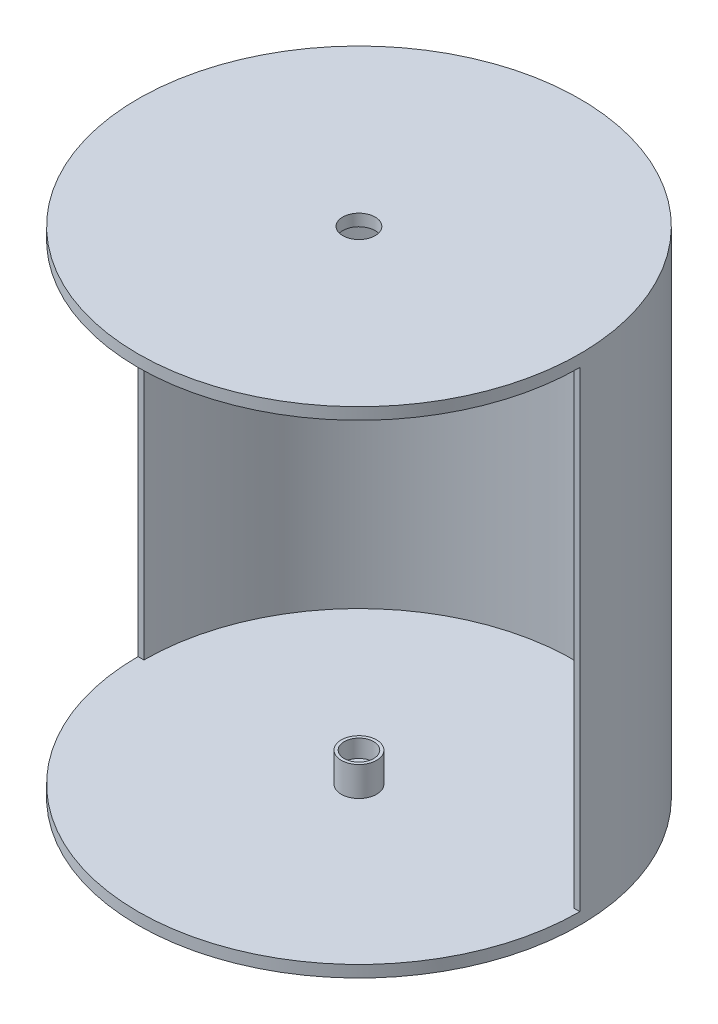
from build123d import *

# Parameters (mm, degrees)
SKETCH1_R           = 37.5
BOSS_EXTRUDE1_DEPTH = 2
SKETCH2_R           = 3
BOSS_EXTRUDE2_DEPTH = 5
SKETCH3_R           = 2.5
CUT_EXTRUDE1_DEPTH  = 3
BOSS_EXTRUDE3_DEPTH = 80
SKETCH5_R           = 37.5
SKETCH5_R_2         = 2.75
BOSS_EXTRUDE4_DEPTH = 2


with BuildPart() as part:
    # Sketch1 → Boss-Extrude1 (new body)
    with BuildSketch(Plane(origin=(0, 0, 0), x_dir=(1, 0, 0), z_dir=(0, 1, 0))):
        with Locations(Location((0, 0, 0), (0, 0, 270))):
            Circle(SKETCH1_R)
    extrude(amount=BOSS_EXTRUDE1_DEPTH)

    # Sketch2 → Boss-Extrude2 (add)
    with BuildSketch(Plane(origin=(0, 2, 0), x_dir=(1, 0, 0), z_dir=(0, 1, 0))):
        with Locations(Location((0, 0, 0), (0, 0, 270))):
            Circle(SKETCH2_R)
    extrude(amount=BOSS_EXTRUDE2_DEPTH)

    # Sketch3 → Cut-Extrude1 (cut)
    with BuildSketch(Plane(origin=(0, 7, 0), x_dir=(1, 0, 0), z_dir=(0, 1, 0))):
        with Locations(Location((0, 0, 0), (0, 0, 270))):
            Circle(SKETCH3_R)
    extrude(amount=-CUT_EXTRUDE1_DEPTH, mode=Mode.SUBTRACT)

    # Sketch4 → Boss-Extrude3 (add)
    with BuildSketch(Plane(origin=(0, 2, 0), x_dir=(1, 0, 0), z_dir=(0, 1, 0))):
        with BuildLine():
            Line((-37.5, 0), (-36.5, 0))
            ThreePointArc((-36.5, 0), (0, 36.5), (36.5, 0))
            Line((36.5, 0), (37.5, 0))
            ThreePointArc((37.5, 0), (0, 37.5), (-37.5, 0))
        make_face()
    extrude(amount=BOSS_EXTRUDE3_DEPTH)

    # Sketch5 → Boss-Extrude4 (add)
    with BuildSketch(Plane(origin=(0, 82, 0), x_dir=(1, 0, 0), z_dir=(0, 1, 0))):
        with Locations(Location((0, 0, 0), (0, 0, 270))):
            Circle(SKETCH5_R)
        with Locations(Location((0, 0, 0), (0, 0, 270))):
            Circle(SKETCH5_R_2, mode=Mode.SUBTRACT)
    extrude(amount=BOSS_EXTRUDE4_DEPTH)


solid = part.part
